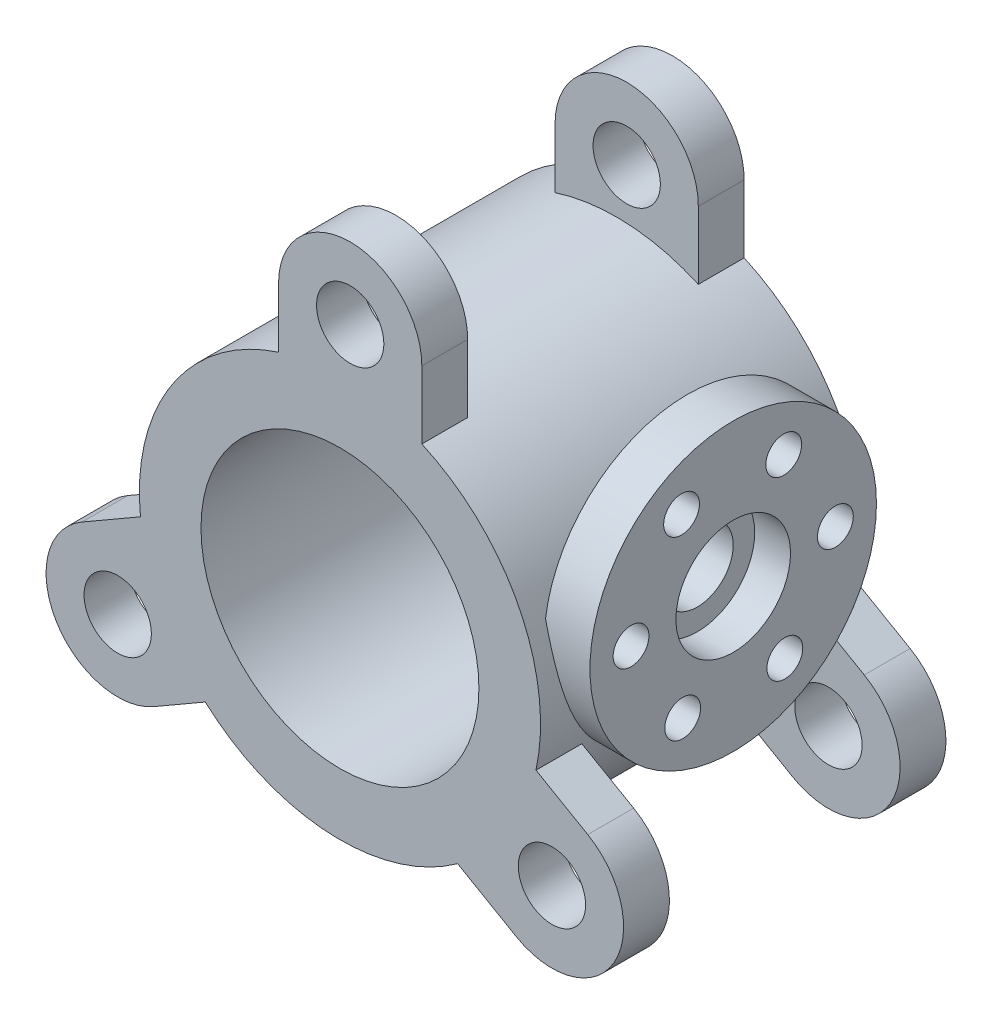
from build123d import *

# Parameters (mm, degrees)
ESQUISSE1_R                  = 140
ESQUISSE1_R_2                = 97
BOSS_EXTRU_1_DEPTH           = 225
BOSS_EXTRU_2_START           = -32
ESQUISSE2_R                  = 23.5
BOSS_EXTRU_2_DEPTH           = 32
R_P_TITION_CIRCULAIRE1_COUNT = 3
SYM_TRIE3_START              = -32
SYM_TRIE3_COPY_1_SKETCH_R    = 23.5
SYM_TRIE3_COPY_1_DEPTH       = 32
SYM_TRIE3_COPY_2_SKETCH_R    = 23.5
SYM_TRIE3_COPY_2_DEPTH       = 32
ESQUISSE3_R                  = 100
BOSS_EXTRU_3_DEPTH           = 32
ESQUISSE4_R                  = 40
ENL_V_MAT_EXTRU_1_DEPTH      = 25
ESQUISSE5_R                  = 25
ENL_V_MAT_EXTRU_4_DEPTH      = 468.228990121
ESQUISSE6_R                  = 12.5
ENL_V_MAT_EXTRU_5_DEPTH      = 45
R_P_TITION_CIRCULAIRE2_COUNT = 6


with BuildPart() as part:
    # Esquisse1 → Boss.-Extru.1 (new body)
    with BuildSketch(Plane(origin=(0, 0, 0), x_dir=(0, 1, 0), z_dir=(0, 0, 1))):
        with Locations(Location((0, 0, 0), (0, 0, 270))):
            Circle(ESQUISSE1_R)
        with Locations(Location((0, 0, 0), (0, 0, 270))):
            Circle(ESQUISSE1_R_2, mode=Mode.SUBTRACT)
    extrude(amount=BOSS_EXTRU_1_DEPTH)

    # Esquisse2 → Boss.-Extru.2 (add)
    with BuildSketch(Plane.XY.offset(225).offset(BOSS_EXTRU_2_START)):
        with BuildLine():
            Line((-42.848913936, 175), (-42.848913936, 133.281546264))
            ThreePointArc((-42.848913936, 133.281546264), (7.657681027, 139.790414268), (57.151086064, 127.803573352))
            Line((57.151086064, 127.803573352), (57.151086064, 175))
            ThreePointArc((57.151086064, 175), (7.151086064, 225), (-42.848913936, 175))
        make_face()
        with Locations((7.151086064, 175)):
            Circle(ESQUISSE2_R, mode=Mode.SUBTRACT)
    boss_extru_2 = extrude(amount=BOSS_EXTRU_2_DEPTH)

    # Répétition circulaire1: Boss.-Extru.2 ×3 about axis
    r_p_tition_circulaire1_axis = Axis((0, 0, 0), (0, 0, 1))
    for i in range(1, R_P_TITION_CIRCULAIRE1_COUNT):
        add(boss_extru_2.rotate(r_p_tition_circulaire1_axis, i * 360 / R_P_TITION_CIRCULAIRE1_COUNT))

    # Symétrie3: Boss.-Extru.2 across plane
    add(boss_extru_2.mirror(Plane.XY.offset(112.5)))

    # Symétrie3 copy 1 sketch → Symétrie3 copy 1 (add)
    with BuildSketch(Plane(origin=(0, 0, 0), x_dir=(-0.4999999999999998, 0.8660254037844387, 0), z_dir=(0, 0, -1)).offset(SYM_TRIE3_START)):
        with BuildLine():
            Line((-42.848913936, -175), (-42.848913936, -133.281546264))
            ThreePointArc((-42.848913936, -133.281546264), (7.657681027, -139.790414268), (57.151086064, -127.803573352))
            Line((57.151086064, -127.803573352), (57.151086064, -175))
            ThreePointArc((57.151086064, -175), (7.151086064, -225), (-42.848913936, -175))
        make_face()
        with Locations((7.151086064, -175)):
            Circle(SYM_TRIE3_COPY_1_SKETCH_R, mode=Mode.SUBTRACT)
    extrude(amount=SYM_TRIE3_COPY_1_DEPTH)

    # Symétrie3 copy 2 sketch → Symétrie3 copy 2 (add)
    with BuildSketch(Plane(origin=(0, 0, 0), x_dir=(-0.5000000000000004, -0.8660254037844384, 0), z_dir=(0, 0, -1)).offset(SYM_TRIE3_START)):
        with BuildLine():
            Line((-42.848913936, -175), (-42.848913936, -133.281546264))
            ThreePointArc((-42.848913936, -133.281546264), (7.657681027, -139.790414268), (57.151086064, -127.803573352))
            Line((57.151086064, -127.803573352), (57.151086064, -175))
            ThreePointArc((57.151086064, -175), (7.151086064, -225), (-42.848913936, -175))
        make_face()
        with Locations((7.151086064, -175)):
            Circle(SYM_TRIE3_COPY_2_SKETCH_R, mode=Mode.SUBTRACT)
    extrude(amount=SYM_TRIE3_COPY_2_DEPTH)

    # Esquisse3 → Boss.-Extru.3 (add)
    with BuildSketch(Plane.YZ.offset(162)):
        with Locations(Location((37.953751354, 112.5, 0), (0, 0, 270))):
            Circle(ESQUISSE3_R)
    extrude(amount=-BOSS_EXTRU_3_DEPTH)

    # Esquisse4 → Enlèv. mat.-Extru.1 (cut)
    with BuildSketch(Plane.YZ.offset(162)):
        with Locations(Location((37.953751354, 112.5, 0), (0, 0, 270))):
            Circle(ESQUISSE4_R)
    extrude(amount=-ENL_V_MAT_EXTRU_1_DEPTH, mode=Mode.SUBTRACT)

    # Esquisse5 → Enlèv. mat.-Extru.4 (cut, through all)
    with BuildSketch(Plane.YZ.offset(137)):
        with Locations(Location((37.953751354, 112.5, 0), (0, 0, 270))):
            Circle(ESQUISSE5_R)
    extrude(amount=-ENL_V_MAT_EXTRU_4_DEPTH, mode=Mode.SUBTRACT)

    # Esquisse6 → Enlèv. mat.-Extru.5 (cut)
    with BuildSketch(Plane.YZ.offset(162)):
        with Locations(Location((37.503795096, 183.818066879, 0), (0, 0, 270))):
            Circle(ESQUISSE6_R)
    enl_v_mat_extru_5 = extrude(amount=-ENL_V_MAT_EXTRU_5_DEPTH, mode=Mode.SUBTRACT)

    # Répétition circulaire2: Enlèv. mat.-Extru.5 ×6 about axis
    r_p_tition_circulaire2_axis = Axis((0, 37.953751354, 112.5), (1, 0, 0))
    for i in range(1, R_P_TITION_CIRCULAIRE2_COUNT):
        add(enl_v_mat_extru_5.rotate(r_p_tition_circulaire2_axis, i * 360 / R_P_TITION_CIRCULAIRE2_COUNT), mode=Mode.SUBTRACT)


solid = part.part
